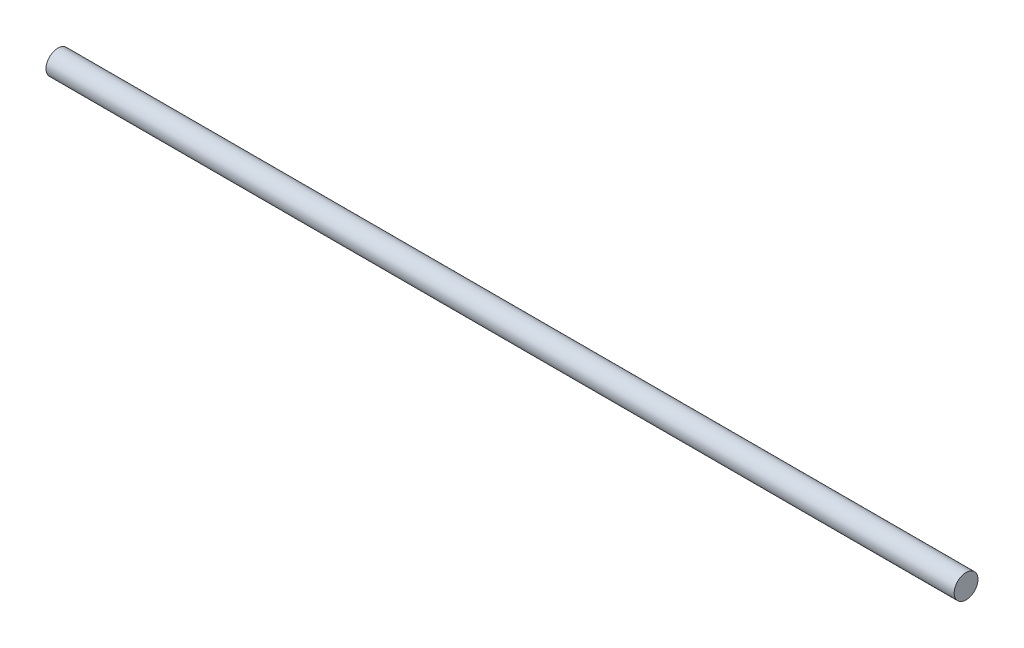
from build123d import *

# Parameters (mm, degrees)
SKETCH1_R           = 4
BOSS_EXTRUDE1_DEPTH = 305


with BuildPart() as part:
    # Sketch1 → Boss-Extrude1 (new body)
    with BuildSketch(Plane(origin=(0, 0, 0), x_dir=(0, 0, -1), z_dir=(1, 0, 0))):
        Circle(SKETCH1_R)
    extrude(amount=BOSS_EXTRUDE1_DEPTH)


solid = part.part
